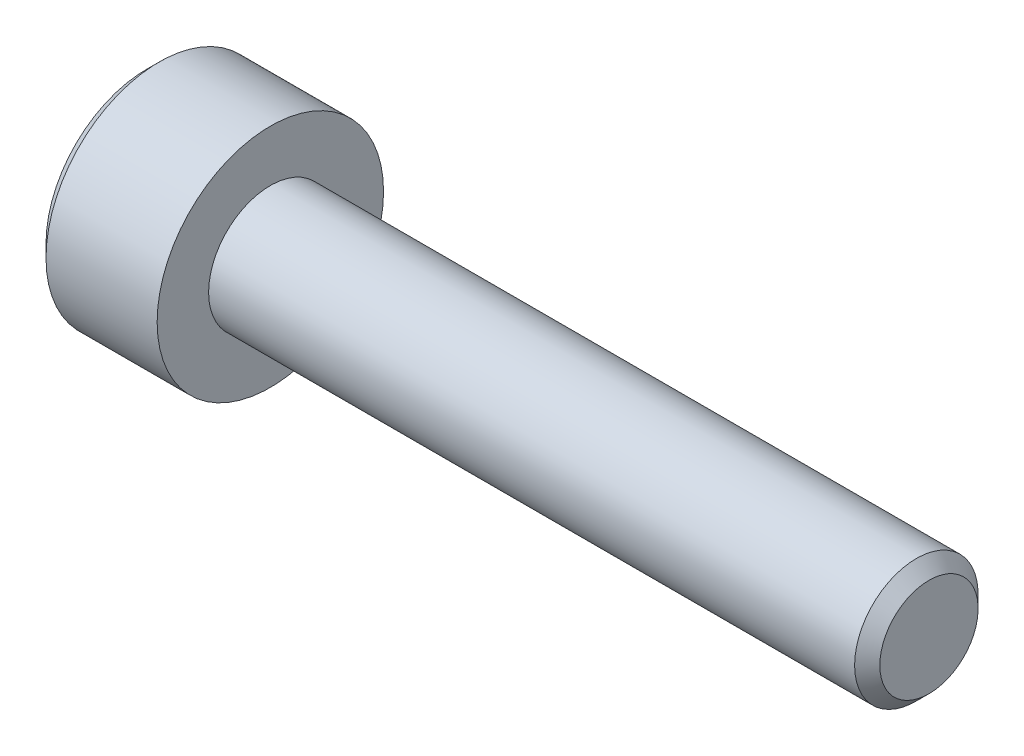
from build123d import *

# Parameters (mm, degrees)
CUT_EXTRUDE1_DEPTH = 1.5


with BuildPart() as part:
    # Sketch1 → Revolve1 (revolve)
    with BuildSketch(Plane.XY):
        Polygon((-3, 0), (16, 0), (16, -1.1935), (15.6935, -1.5), (0, -1.5), (0, -2.75), (-2.7, -2.75), (-3, -2.45), align=None)
    revolve(axis=Axis((-3.95, 0, 0), (1, 0, 0)))

    # Sketch2 → Cut-Extrude1 (cut)
    with BuildSketch(Plane.ZY.offset(3)):
        Polygon((0, 1.443375673), (-1.25, 0.721687836), (-1.25, -0.721687836), (0, -1.443375673), (1.25, -0.721687836), (1.25, 0.721687836), align=None)
    extrude(amount=-CUT_EXTRUDE1_DEPTH, mode=Mode.SUBTRACT)


solid = part.part
